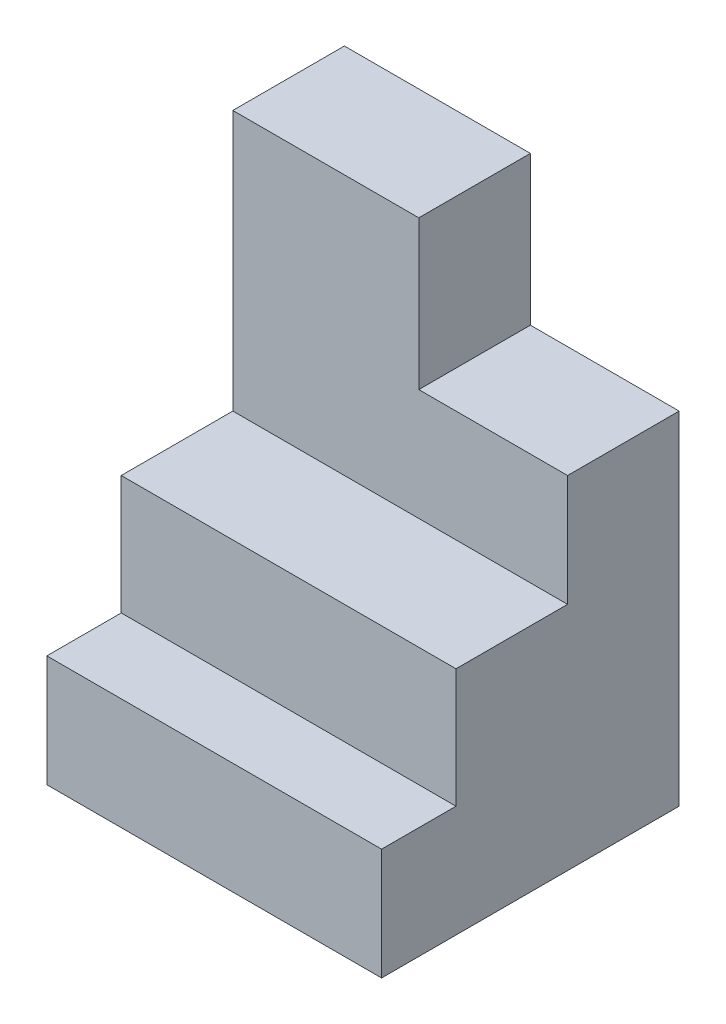
from build123d import *

# Parameters (mm, degrees)
RESSALTO_EXTRUS_O1_DEPTH = 0.75
ESBO_O2_W                = 2.25
ESBO_O2_H                = 1.55
RESSALTO_EXTRUS_O2_DEPTH = 1.25
ESBO_O4_W                = 0.5
ESBO_O4_H                = 0.8
CORTE_EXTRUS_O1_DEPTH    = 4.432928779


with BuildPart() as part:
    # Esboço1 → Ressalto-extrusão1 (new body)
    with BuildSketch(Plane.XY):
        Polygon((-1.125, -1.65), (1.125, -1.65), (1.125, 0.65), (0.125, 0.65), (0.125, 1.65), (-1.125, 1.65), align=None)
    extrude(amount=RESSALTO_EXTRUS_O1_DEPTH)

    # Esboço2 → Ressalto-extrusão2 (add)
    with BuildSketch(Plane.XY.offset(0.75)):
        with Locations((0, -0.875)):
            Rectangle(ESBO_O2_W, ESBO_O2_H)
    extrude(amount=RESSALTO_EXTRUS_O2_DEPTH)

    # Esboço4 → Corte-extrusão1 (cut, through all)
    with BuildSketch(Plane.ZY.offset(1.125)):
        with Locations((1.75, -0.5)):
            Rectangle(ESBO_O4_W, ESBO_O4_H)
    extrude(amount=-CORTE_EXTRUS_O1_DEPTH, mode=Mode.SUBTRACT)


solid = part.part
